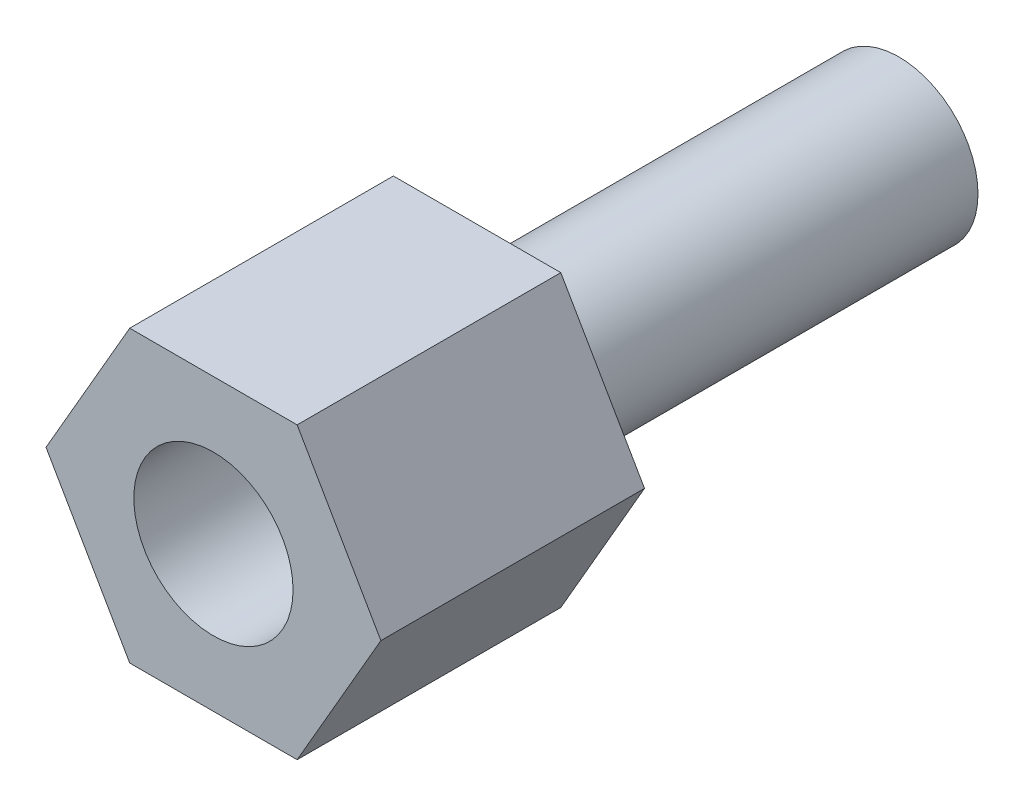
from build123d import *

# Parameters (mm, degrees)
FEMALE_HEX_STANDOFF_SKETCH_R  = 1.51
FEMALE_HEX_STANDOFF_DEPTH     = 5
STUD_ROOT_SKETCH_R            = 1.85
STUD_ROOT_DEPTH               = 0.45
MALE_THREAD_ENVELOPE_START    = -8
MALE_THREAD_ENVELOPE_SKETCH_R = 1.5
MALE_THREAD_ENVELOPE_DEPTH    = 8


with BuildPart() as part:
    # Female_hex_standoff_Sketch → Female_hex_standoff (new body)
    with BuildSketch(Plane.XY):
        Polygon((3.175426481, 0), (1.58771324, 2.75), (-1.58771324, 2.75), (-3.175426481, 0), (-1.58771324, -2.75), (1.58771324, -2.75), align=None)
        Circle(FEMALE_HEX_STANDOFF_SKETCH_R, mode=Mode.SUBTRACT)
    extrude(amount=FEMALE_HEX_STANDOFF_DEPTH)

    # Stud_root_Sketch → Stud_root (add)
    with BuildSketch(Plane.XY):
        Circle(STUD_ROOT_SKETCH_R)
    extrude(amount=STUD_ROOT_DEPTH)

    # Male_thread_envelope_Sketch → Male_thread_envelope (add)
    with BuildSketch(Plane.XY.offset(MALE_THREAD_ENVELOPE_START)):
        Circle(MALE_THREAD_ENVELOPE_SKETCH_R)
    extrude(amount=MALE_THREAD_ENVELOPE_DEPTH)


solid = part.part
